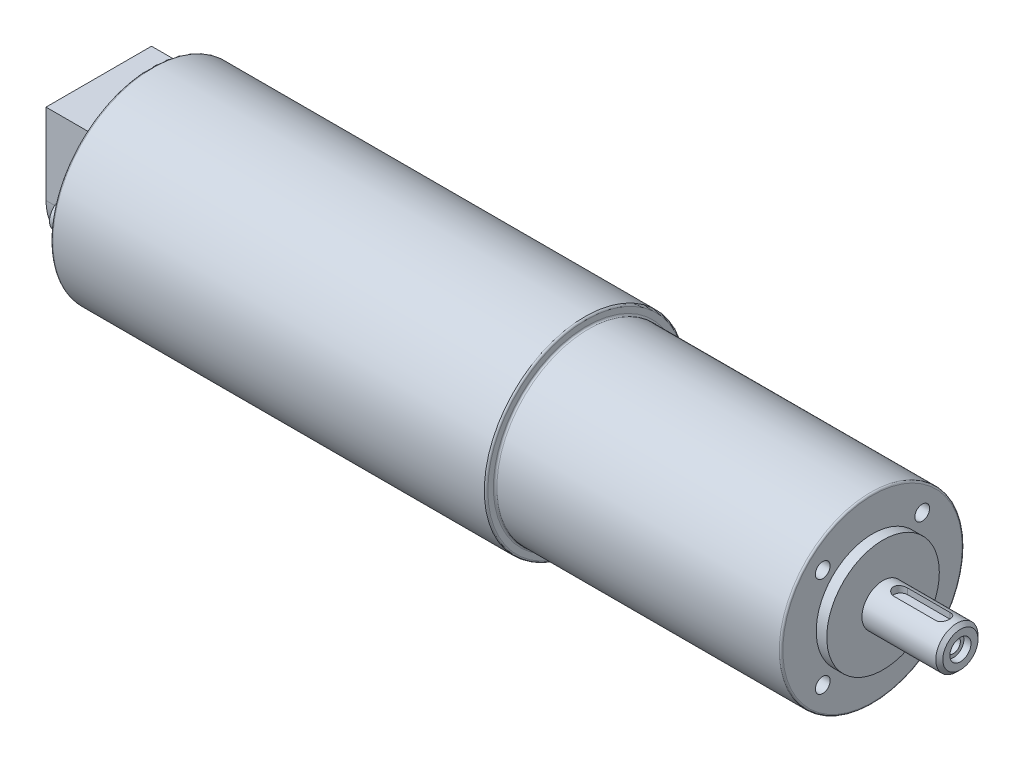
from build123d import *

# Parameters (mm, degrees)
SKETCH1_R             = 28.575
BOSS_EXTRUDE1_DEPTH   = 123.7
SKETCH2_R             = 26
BOSS_EXTRUDE2_DEPTH   = 81.3
SKETCH3_R             = 16
BOSS_EXTRUDE3_DEPTH   = 3
SKETCH4_R             = 6
BOSS_EXTRUDE4_DEPTH   = 22
CHAMFER1_SIZE         = 1
SKETCH6_R             = 3
CUT_EXTRUDE1_DEPTH    = 2
FILLET1_R             = 0.5
M5_TAPPED_HOLE1_D     = 4.2
M5_TAPPED_HOLE1_DEPTH = 12.4
M5_TAPPED_HOLE1_TIP   = 1.2618073
BOSS_EXTRUDE6_DEPTH   = 15
SKETCH14_R            = 1.75
BOSS_EXTRUDE7_DEPTH   = 5
CUT_EXTRUDE3_DEPTH    = 10


with BuildPart() as part:
    # Sketch1 → Boss-Extrude1 (new body)
    with BuildSketch(Plane(origin=(0, 0, 0), x_dir=(0, 0, -1), z_dir=(1, 0, 0))):
        Circle(SKETCH1_R)
    extrude(amount=BOSS_EXTRUDE1_DEPTH)

    # Sketch2 → Boss-Extrude2 (add)
    with BuildSketch(Plane(origin=(205, 0, 0), x_dir=(0, 0, -1), z_dir=(1, 0, 0))):
        Circle(SKETCH2_R)
    extrude(amount=-BOSS_EXTRUDE2_DEPTH)

    # Sketch3 → Boss-Extrude3 (add)
    with BuildSketch(Plane(origin=(205, 0, 0), x_dir=(0, 0, -1), z_dir=(1, 0, 0))):
        Circle(SKETCH3_R)
    extrude(amount=BOSS_EXTRUDE3_DEPTH)

    # Sketch4 → Boss-Extrude4 (add)
    with BuildSketch(Plane(origin=(208, 0, 0), x_dir=(0, 0, -1), z_dir=(1, 0, 0))):
        Circle(SKETCH4_R)
    extrude(amount=BOSS_EXTRUDE4_DEPTH)

    # Chamfer1
    chamfer1_edges = [part.edges().sort_by_distance(p)[0] for p in [
        (230, 0, 6),
    ]]
    chamfer(chamfer1_edges, length=CHAMFER1_SIZE)

    # Sketch6 → Cut-Extrude1 (cut)
    with BuildSketch(Plane(origin=(230, 0, 0), x_dir=(0, 0, -1), z_dir=(1, 0, 0))):
        Circle(SKETCH6_R)
    extrude(amount=-CUT_EXTRUDE1_DEPTH, mode=Mode.SUBTRACT)

    # Fillet1
    fillet1_edges = [part.edges().sort_by_distance(p)[0] for p in [
        (0, 0, 28.575),
        (123.7, 0, 28.575),
        (123.7, 0, 26),
        (205, 0, 26),
    ]]
    fillet(fillet1_edges, radius=FILLET1_R)

    # Sketch8 → M4 Tapped Hole1 (revolve, cut)
    with BuildSketch(Plane(origin=(230, 0, 0), x_dir=(0, 0, -1), z_dir=(0, 1, 0))):
        Polygon((0, 0), (0, 12.991420021), (1.65, 12), (1.65, 10), (2, 10), (2, 0), align=None)
    revolve(axis=Axis((236.35, 0, 0), (-1, 0, 0)), mode=Mode.SUBTRACT)

    # M5 Tapped Hole1
    with Locations(Plane(origin=(205, 14.142135624, -14.142135624), x_dir=(0, 0, 1), z_dir=(1, 0, 0))):
        with Locations((0, 0), (28.284271248, 0), (0, 28.284271248), (28.284271248, 28.284271248)):
            Hole(M5_TAPPED_HOLE1_D / 2, depth=M5_TAPPED_HOLE1_DEPTH)
            with Locations((0, 0, -(M5_TAPPED_HOLE1_DEPTH + M5_TAPPED_HOLE1_TIP / 2))):  # 118° drill point
                Cone(0, M5_TAPPED_HOLE1_D / 2, M5_TAPPED_HOLE1_TIP, mode=Mode.SUBTRACT)

    # Sketch13 → Boss-Extrude6 (add)
    with BuildSketch(Plane.ZY):
        with BuildLine():
            Line((-15, 18.575), (15, 18.575))
            Line((15, 18.575), (15, -4.425))
            ThreePointArc((15, -4.425), (0, -19.425), (-15, -4.425))
            Line((-15, -4.425), (-15, 18.575))
        make_face()
    extrude(amount=BOSS_EXTRUDE6_DEPTH)

    # Sketch14 → Boss-Extrude7 (add)
    # profile 1 of 2: a face of its own
    with BuildSketch(Plane.ZY):
        with BuildLine():
            Line((20, 4), (15, 6.331538291))
            Line((15, 6.331538291), (15, -6.331538291))
            Line((15, -6.331538291), (20, -4))
            ThreePointArc((20, -4), (24, 0), (20, 4))
        make_face()
        with Locations((20, 0)):
            Circle(SKETCH14_R, mode=Mode.SUBTRACT)
    # profile 2 of 2: a face of its own
    with BuildSketch(Plane.ZY):
        with BuildLine():
            Line((-20, -4), (-15, -6.331538291))
            Line((-15, -6.331538291), (-15, 6.331538291))
            Line((-15, 6.331538291), (-20, 4))
            ThreePointArc((-20, 4), (-24, 0), (-20, -4))
        make_face()
        with Locations(Location((-20, 0, 0), (0, 0, 180))):
            Circle(SKETCH14_R, mode=Mode.SUBTRACT)
    extrude(amount=BOSS_EXTRUDE7_DEPTH)

    # Sketch15 → Cut-Extrude3 (cut)
    with BuildSketch(Plane(origin=(0, 4, 0), x_dir=(1, 0, 0), z_dir=(0, 1, 0))):
        with BuildLine():
            Line((225, -2), (213, -2))
            ThreePointArc((213, -2), (211, 0), (213, 2))
            Line((213, 2), (225, 2))
            ThreePointArc((225, 2), (227, 0), (225, -2))
        make_face()
    extrude(amount=CUT_EXTRUDE3_DEPTH, mode=Mode.SUBTRACT)


solid = part.part
